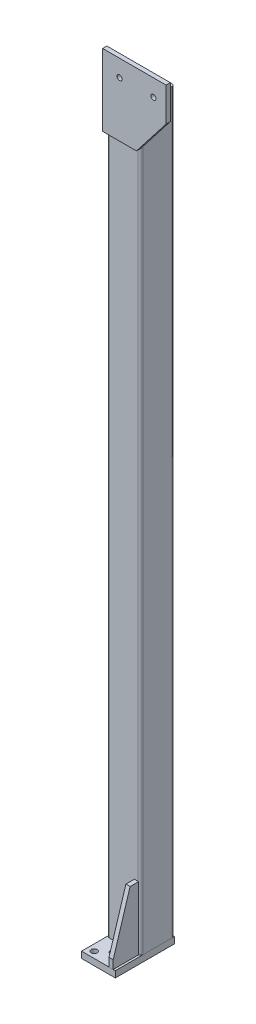
from build123d import *

# Parameters (mm, degrees)
MEMBER_1_DEPTH                   = 1745
SKETCH_4_W                       = 80
SKETCH_4_H                       = 140
EXTRUDE_1_DEPTH                  = 15
HOLE_WIZARD_14_0_14_1_AT_2_COUNT = 2
HOLE_WIZARD_14_0_14_1_AT_2_PITCH = 32.015621187
EXTRUDE_2_DEPTH                  = 10
EXTRUDE_3_DEPTH                  = 10
HOLE_WIZARD_M10_1_AT_2_COUNT     = 2
HOLE_WIZARD_M10_1_AT_2_PITCH     = 80
HOLE_WIZARD_M8_2_AT_2_COUNT      = 2
HOLE_WIZARD_M8_2_AT_2_PITCH      = 670
HOLE_WIZARD_M8_2_AT_3_COUNT      = 2
HOLE_WIZARD_M8_2_AT_3_PITCH      = 350
HOLE_WIZARD_M8_2_AT_4_COUNT      = 2
HOLE_WIZARD_M8_2_AT_4_PITCH      = 930
HOLE_WIZARD_M8_7_AT_2_COUNT      = 2
HOLE_WIZARD_M8_7_AT_2_PITCH      = 800


with BuildPart() as part:
    # Sketch11 → Member 1 (new body)
    with BuildSketch(Plane(origin=(0, 1745, 0), x_dir=(0, 0, 1), z_dir=(0, -1, 0))):
        with BuildLine():
            Line((-34, -40), (34, -40))
            ThreePointArc((34, -40), (38.242640687, -38.242640687), (40, -34))
            Line((40, -34), (40, 34))
            ThreePointArc((40, 34), (38.242640687, 38.242640687), (34, 40))
            Line((34, 40), (-34, 40))
            ThreePointArc((-34, 40), (-38.242640687, 38.242640687), (-40, 34))
            Line((-40, 34), (-40, -34))
            ThreePointArc((-40, -34), (-38.242640687, -38.242640687), (-34, -40))
        make_face()
        with BuildLine():
            Line((-34, -36), (34, -36))
            ThreePointArc((34, -36), (35.414213562, -35.414213562), (36, -34))
            Line((36, -34), (36, 34))
            ThreePointArc((36, 34), (35.414213562, 35.414213562), (34, 36))
            Line((34, 36), (-34, 36))
            ThreePointArc((-34, 36), (-35.414213562, 35.414213562), (-36, 34))
            Line((-36, 34), (-36, -34))
            ThreePointArc((-36, -34), (-35.414213562, -35.414213562), (-34, -36))
        make_face(mode=Mode.SUBTRACT)
    extrude(amount=MEMBER_1_DEPTH)

    # 草图33 → M8 螺纹孔2 (revolve, cut)
    with BuildSketch(Plane(origin=(-40, 665, -20), x_dir=(0, 0, 1), z_dir=(0, 1, 0))):
        Polygon((0, 0), (0, 21.792926105), (3.4, 19.75), (3.4, 0), align=None)
    hole_wizard_m8_2 = revolve(axis=Axis((-46.35, 665, -20), (1, 0, 0)), mode=Mode.SUBTRACT)

    # M8 螺纹孔2 at 2: M8 螺纹孔2 ×2
    with Locations(*[(0, i * HOLE_WIZARD_M8_2_AT_2_PITCH, 0) for i in range(1, HOLE_WIZARD_M8_2_AT_2_COUNT)]):
        add(hole_wizard_m8_2, mode=Mode.SUBTRACT)

    # M8 螺纹孔2 at 3: M8 螺纹孔2 ×2
    with Locations(*[(0, i * HOLE_WIZARD_M8_2_AT_3_PITCH, 0) for i in range(1, HOLE_WIZARD_M8_2_AT_3_COUNT)]):
        add(hole_wizard_m8_2, mode=Mode.SUBTRACT)

    # M8 螺纹孔2 at 4: M8 螺纹孔2 ×2
    with Locations(*[(0, i * HOLE_WIZARD_M8_2_AT_4_PITCH, 0) for i in range(1, HOLE_WIZARD_M8_2_AT_4_COUNT)]):
        add(hole_wizard_m8_2, mode=Mode.SUBTRACT)

    # 草图43 → M8 螺纹孔7 (revolve, cut)
    with BuildSketch(Plane(origin=(-40, 1117, 20.000000001), x_dir=(0, 0, 1), z_dir=(0, 1, 0))):
        Polygon((0, 0), (0, 24.292926105), (3.4, 22.25), (3.4, 0), align=None)
    hole_wizard_m8_7 = revolve(axis=Axis((-46.35, 1117, 20.000000001), (1, 0, 0)), mode=Mode.SUBTRACT)

    # M8 螺纹孔7 at 2: M8 螺纹孔7 ×2
    with Locations(*[(0, -i * HOLE_WIZARD_M8_7_AT_2_PITCH, 0) for i in range(1, HOLE_WIZARD_M8_7_AT_2_COUNT)]):
        add(hole_wizard_m8_7, mode=Mode.SUBTRACT)


with BuildPart() as body_2:
    # 草图4 → 凸台-拉伸1 (new body)
    with BuildSketch(Plane.XZ):
        with Locations((0, 30)):
            Rectangle(SKETCH_4_W, SKETCH_4_H)
    extrude(amount=EXTRUDE_1_DEPTH)

    # 草图12 → Ø14.0 (14) 直径孔1 (revolve, cut)
    with BuildSketch(Plane(origin=(-25, 0, 85), x_dir=(0, 0, 1), z_dir=(1, 0, 0))):
        Polygon((0, 0), (0, 44.206024333), (7, 40), (7, 0), align=None)
    hole_wizard_14_0_14_1 = revolve(axis=Axis((-25, 6.35, 85), (0, -1, 0)), mode=Mode.SUBTRACT)

    # Ø14.0 (14) 直径孔1 at 2: Ø14.0 (14) 直径孔1 ×2
    with Locations(*[Vector(0.7808688094430305, 0, -0.6246950475544242) * (i * HOLE_WIZARD_14_0_14_1_AT_2_PITCH) for i in range(1, HOLE_WIZARD_14_0_14_1_AT_2_COUNT)]):
        add(hole_wizard_14_0_14_1, mode=Mode.SUBTRACT)


with BuildPart() as body_3:
    # 草图11 → 凸台-拉伸2 (new body)
    with BuildSketch(Plane(origin=(25, 0, 0), x_dir=(0, 0, -1), z_dir=(1, 0, 0))):
        Polygon((-100, 20), (-60, 150), (-40, 150), (-40, 0), (-100, 0), align=None)
    extrude(amount=EXTRUDE_2_DEPTH)


with BuildPart() as body_4:
    # 草图22 → 凸台-拉伸3 (new body)
    with BuildSketch(Plane.XY.offset(40)):
        Polygon((-40, 1655), (-40, 1825), (110, 1825), (110, 1745), (40, 1655), align=None)
    extrude(amount=EXTRUDE_3_DEPTH)

    # 草图29 → M10 间隙孔1 (revolve, cut)
    with BuildSketch(Plane(origin=(80, 1785, 40), x_dir=(0, 1, 0), z_dir=(1, 0, 0))):
        Polygon((0, 0), (0, 33.605163714), (6, 30), (6, 0), align=None)
    hole_wizard_m10_1 = revolve(axis=Axis((80, 1785, 33.65), (0, 0, 1)), mode=Mode.SUBTRACT)

    # M10 间隙孔1 at 2: M10 间隙孔1 ×2
    with Locations(*[(-i * HOLE_WIZARD_M10_1_AT_2_PITCH, 0, 0) for i in range(1, HOLE_WIZARD_M10_1_AT_2_COUNT)]):
        add(hole_wizard_m10_1, mode=Mode.SUBTRACT)


solid = Compound([part.part, body_2.part, body_3.part, body_4.part])
